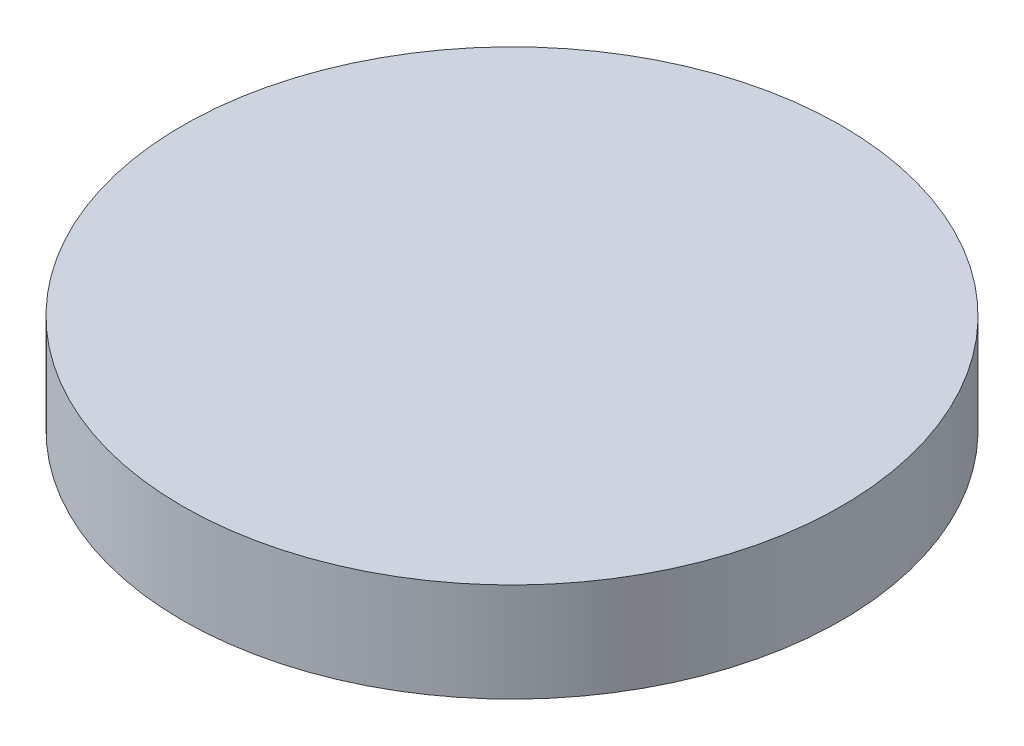
from build123d import *

# Parameters (mm, degrees)
SKETCH1_R           = 10
BOSS_EXTRUDE1_DEPTH = 3


with BuildPart() as part:
    # Sketch1 → Boss-Extrude1 (new body)
    with BuildSketch(Plane(origin=(0, 0, 0), x_dir=(1, 0, 0), z_dir=(0, 1, 0))):
        with Locations(Location((0, 0, 0), (0, 0, 270))):
            Circle(SKETCH1_R)
    extrude(amount=BOSS_EXTRUDE1_DEPTH)


solid = part.part
